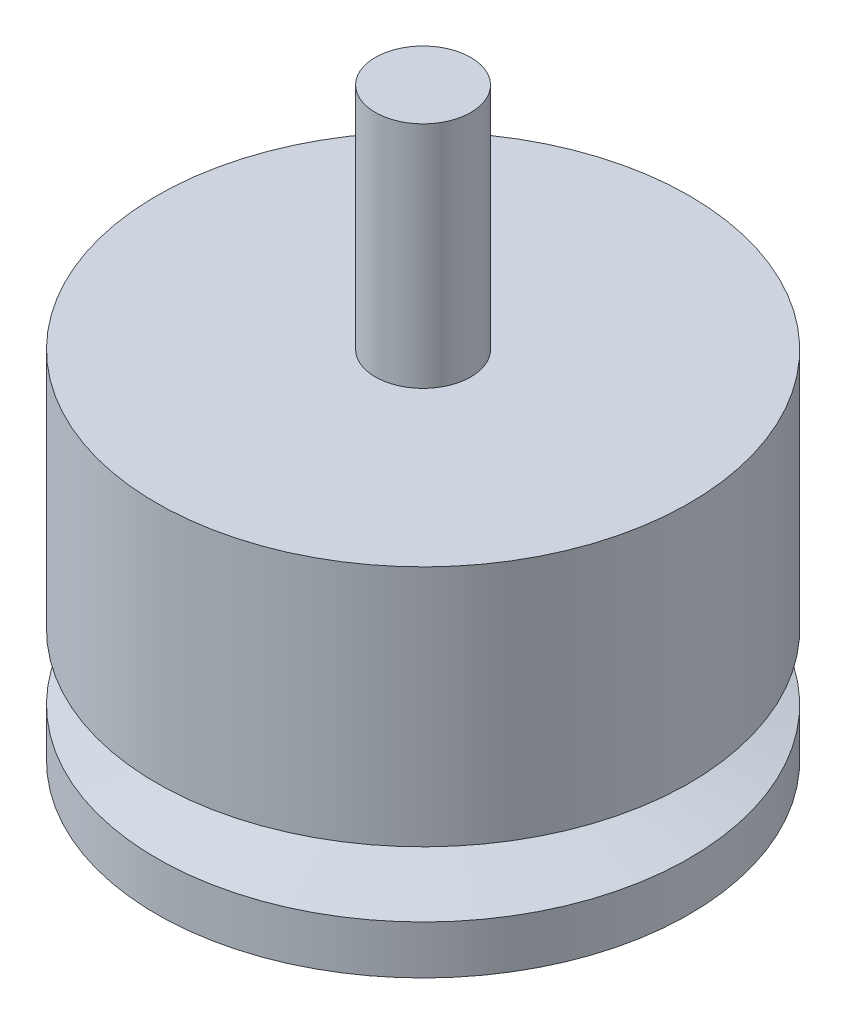
from build123d import *

# Parameters (mm, degrees)
M3_5X0_6_TAPPED_HOLE1_D     = 2.9
M3_5X0_6_TAPPED_HOLE1_DEPTH = 4.064
M3_5X0_6_TAPPED_HOLE1_TIP   = 0.871247898


with BuildPart() as part:
    # Sketch1 → Revolve1 (revolve)
    with BuildSketch(Plane.XY, mode=Mode.PRIVATE) as revolve1_sk:
        Polygon((0, 30.65), (0, 0), (13.95, 0), (13.95, 2.54), (2.54, 5.08), (2.54, 5.95), (13.95, 5.95), (13.95, 18.65), (2.5, 18.65), (2.5, 30.65), align=None)
    revolve(revolve1_sk.sketch.rotate(Axis((0, 0, 0), (0, 1, 0)), 90), axis=Axis((0, 0, 0), (0, 1, 0)))

    # M3.5x0.6 Tapped Hole1
    with Locations(Plane(origin=(-5.656854249, 0, 5.656854249), x_dir=(0, 0, -1), z_dir=(0, -1, 0))):
        with Locations((0, 0), (0, 11.313708498), (11.313708498, 11.313708498), (11.313708498, 0)):
            Hole(M3_5X0_6_TAPPED_HOLE1_D / 2, depth=M3_5X0_6_TAPPED_HOLE1_DEPTH)
            with Locations((0, 0, -(M3_5X0_6_TAPPED_HOLE1_DEPTH + M3_5X0_6_TAPPED_HOLE1_TIP / 2))):  # 118° drill point
                Cone(0, M3_5X0_6_TAPPED_HOLE1_D / 2, M3_5X0_6_TAPPED_HOLE1_TIP, mode=Mode.SUBTRACT)


solid = part.part
